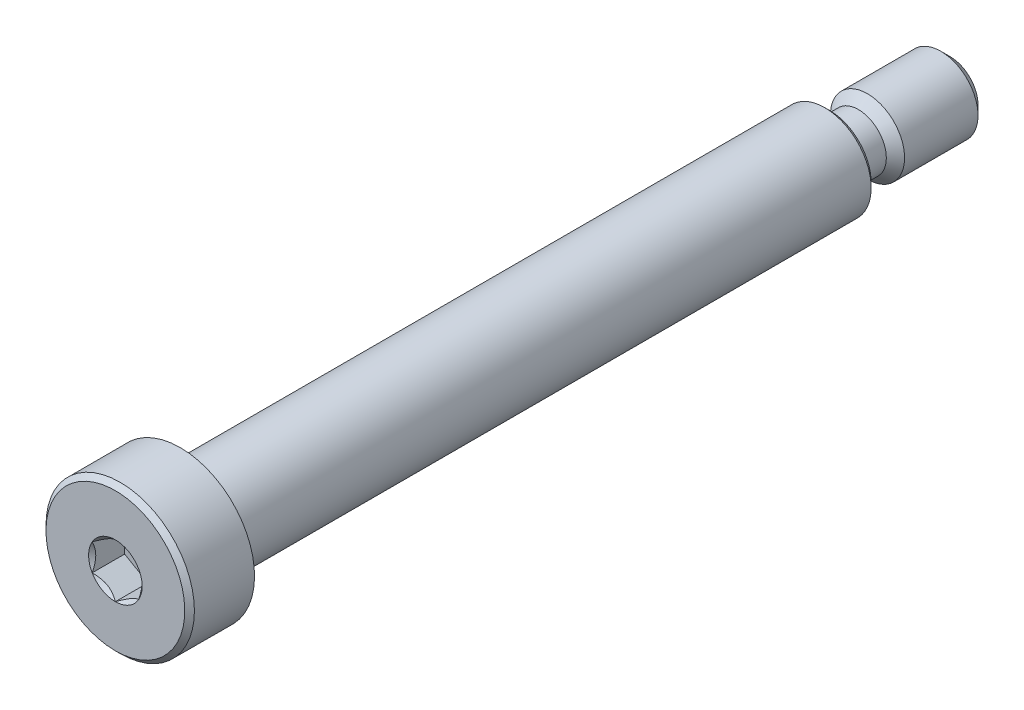
from build123d import *

# Parameters (mm, degrees)
CHAMFER1_SIZE      = 1
CHAMFER2_SIZE      = 0.52
CUT_EXTRUDE2_DEPTH = 3.5


with BuildPart() as part:
    # Sketch1 → Revolve1 (revolve)
    with BuildSketch(Plane(origin=(0, 0, 0), x_dir=(0, 0, -1), z_dir=(1, 0, 0))):
        Polygon((0, 8), (7, 8), (7, 5), (77, 5), (77, 4), (90, 4), (90, 0), (0, 0), align=None)
    revolve(axis=Axis((0, 0, -90), (0, 0, 1)))

    # Sketch5 → Cut-Revolve1 (revolve, cut)
    with BuildSketch(Plane(origin=(0, 0, 0), x_dir=(0, 0, -1), z_dir=(1, 0, 0))):
        with BuildLine():
            Line((77, 5), (82.085, 5))
            Line((82.085, 5), (80.1, 3.015))
            Line((80.1, 3.015), (77.985, 3.015))
            ThreePointArc((77.985, 3.015), (77.288499821, 3.303499821), (77, 4))
            Line((77, 4), (77, 5))
        make_face()
    revolve(axis=Axis((0, 0, -90), (0, 0, 1)), mode=Mode.SUBTRACT)

    # Chamfer1
    chamfer1_edges = [part.edges().sort_by_distance(p)[0] for p in [
        (0, -4, -90),
    ]]
    chamfer(chamfer1_edges, length=CHAMFER1_SIZE)

    # Chamfer2
    chamfer2_edges = [part.edges().sort_by_distance(p)[0] for p in [
        (0, -8, 0),
        (0, -5, -77),
    ]]
    chamfer(chamfer2_edges, length=CHAMFER2_SIZE)

    # Sketch8 → Cut-Extrude2 (cut)
    with BuildSketch(Plane.XY):
        Polygon((2.5, 1.443375673), (0, 2.886751346), (-2.5, 1.443375673), (-2.5, -1.443375673), (0, -2.886751346), (2.5, -1.443375673), align=None)
    extrude(amount=-CUT_EXTRUDE2_DEPTH, mode=Mode.SUBTRACT)

    # Cut-Extrude4 cone 1 section (through the dimple's axis) → Cut-Extrude4 (revolve, cut)
    with BuildSketch(Plane(origin=(0, 0, 0), x_dir=(0, -1, 0), z_dir=(1, 0, 0))):
        Polygon((0, 0), (2.886751346, 0), (0, 2.886751346), align=None)
    revolve(axis=Axis((0, 0, 0), (0, 0, -1)), mode=Mode.SUBTRACT)


solid = part.part
